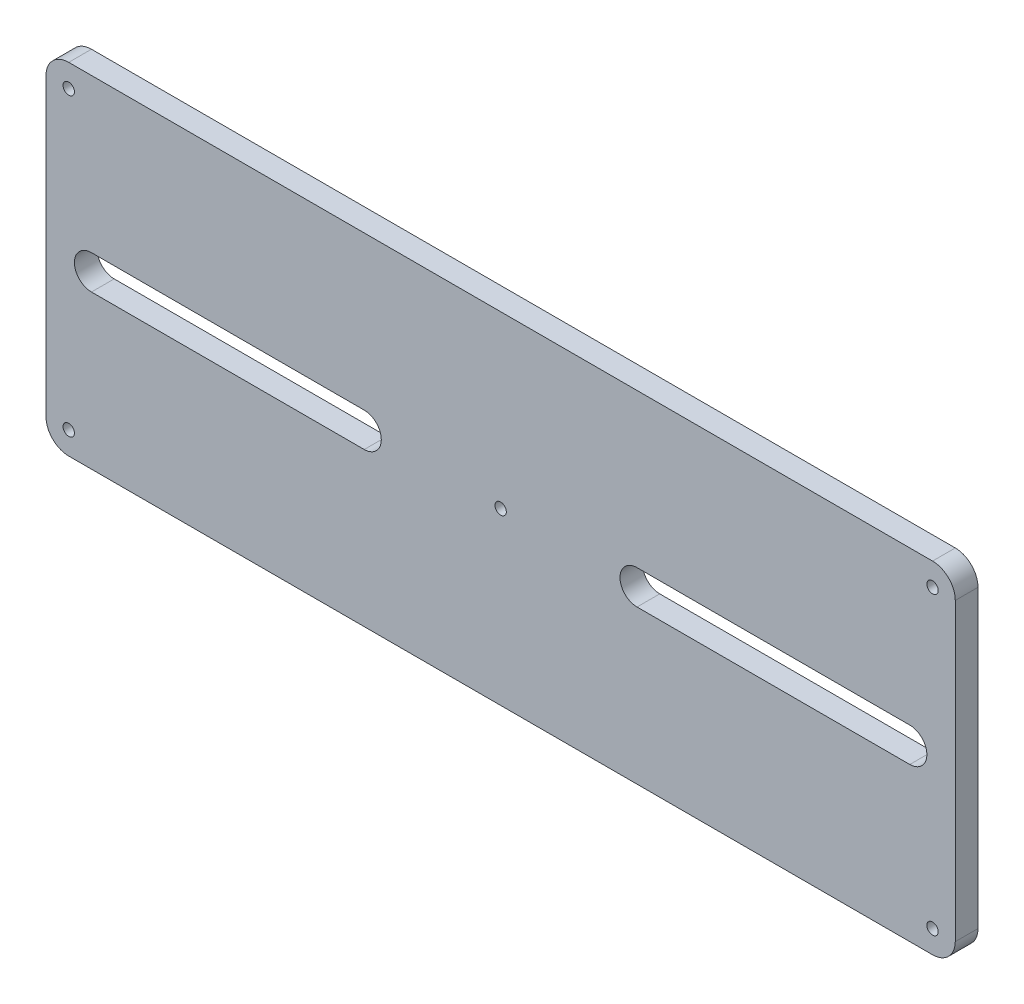
from build123d import *

# Parameters (mm, degrees)
SKETCH1_R           = 2.5
BOSS_EXTRUDE1_DEPTH = 10
SKETCH2_R           = 2.5
CUT_EXTRUDE1_DEPTH  = 10


with BuildPart() as part:
    # Sketch1 → Boss-Extrude1 (new body)
    with BuildSketch(Plane.XY):
        with BuildLine():
            Line((-190, -75), (190, -75))
            ThreePointArc((190, -75), (197.071067812, -72.071067812), (200, -65))
            Line((200, -65), (200, 65))
            ThreePointArc((200, 65), (197.071067812, 72.071067812), (190, 75))
            Line((190, 75), (-190, 75))
            ThreePointArc((-190, 75), (-197.071067812, 72.071067812), (-200, 65))
            Line((-200, 65), (-200, -65))
            ThreePointArc((-200, -65), (-197.071067812, -72.071067812), (-190, -75))
        make_face()
        with Locations((-190, 65)):
            Circle(SKETCH1_R, mode=Mode.SUBTRACT)
        with Locations(Location((-190, -65, 0), (0, 0, 180))):
            Circle(SKETCH1_R, mode=Mode.SUBTRACT)
        with Locations((190, -65)):
            Circle(SKETCH1_R, mode=Mode.SUBTRACT)
        with Locations(Location((190, 65, 0), (0, 0, 180))):
            Circle(SKETCH1_R, mode=Mode.SUBTRACT)
    extrude(amount=BOSS_EXTRUDE1_DEPTH)

    # Sketch2 → Cut-Extrude1 (cut)
    with BuildSketch(Plane.XY.offset(10)):
        Circle(SKETCH2_R)
        with BuildLine():
            Line((-60, -7.5), (-180, -7.5))
            ThreePointArc((-180, -7.5), (-187.5, 0), (-180, 7.5))
            Line((-180, 7.5), (-60, 7.5))
            ThreePointArc((-60, 7.5), (-52.5, 0), (-60, -7.5))
        make_face()
        with BuildLine():
            Line((60, -7.5), (180, -7.5))
            ThreePointArc((180, -7.5), (187.5, 0), (180, 7.5))
            Line((180, 7.5), (60, 7.5))
            ThreePointArc((60, 7.5), (52.5, 0), (60, -7.5))
        make_face()
    extrude(amount=-CUT_EXTRUDE1_DEPTH, mode=Mode.SUBTRACT)


solid = part.part
